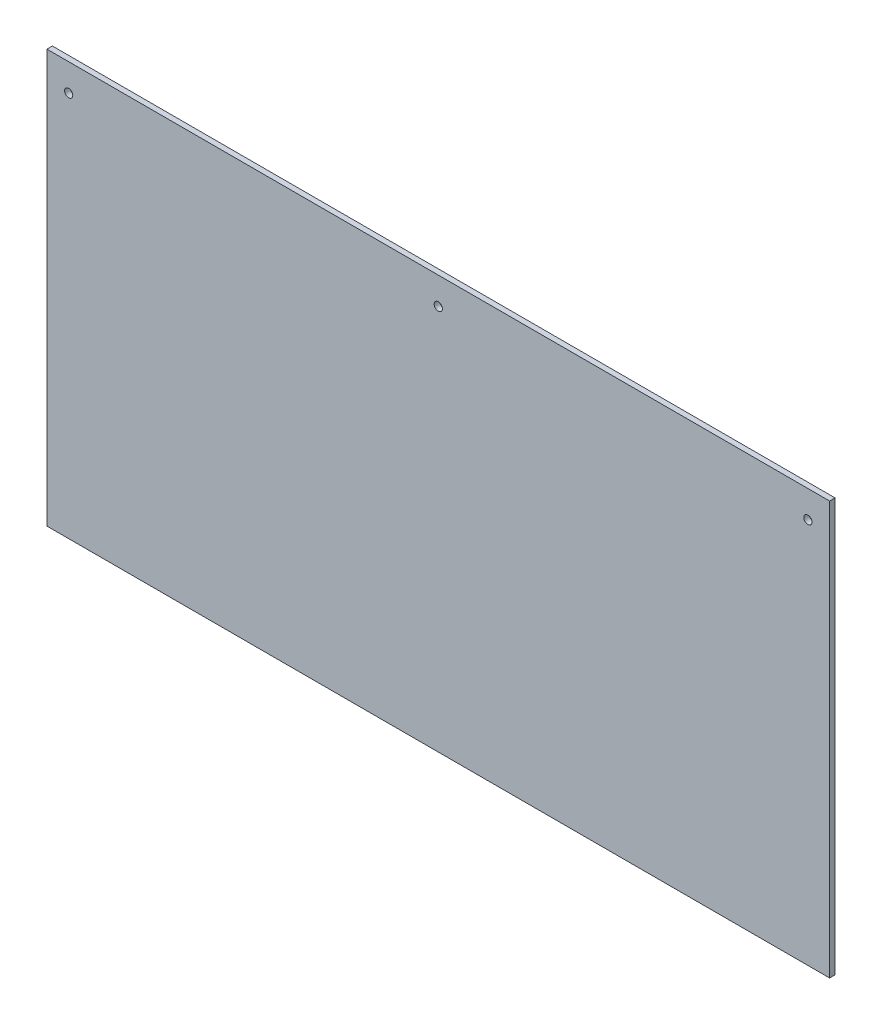
from build123d import *

# Parameters (mm, degrees)
SKETCH1_W           = 914.4
SKETCH1_H           = 482.6
BOSS_EXTRUDE1_DEPTH = 6.35
SKETCH2_R           = 4.7625
CUT_EXTRUDE1_DEPTH  = 1034.958627074
LPATTERN1_COUNT     = 3
LPATTERN1_PITCH     = 431.8


with BuildPart() as part:
    # Sketch1 → Boss-Extrude1 (new body)
    with BuildSketch(Plane.XY):
        with Locations((457.2, 241.3)):
            Rectangle(SKETCH1_W, SKETCH1_H)
    extrude(amount=BOSS_EXTRUDE1_DEPTH)

    # Sketch2 → Cut-Extrude1 (cut, through all)
    with BuildSketch(Plane.XY.offset(6.35)):
        with Locations((25.4, 450.85)):
            Circle(SKETCH2_R)
    cut_extrude1 = extrude(amount=-CUT_EXTRUDE1_DEPTH, mode=Mode.SUBTRACT)

    # LPattern1: Cut-Extrude1 ×3
    with Locations(*[(i * LPATTERN1_PITCH, 0, 0) for i in range(1, LPATTERN1_COUNT)]):
        add(cut_extrude1, mode=Mode.SUBTRACT)


solid = part.part
